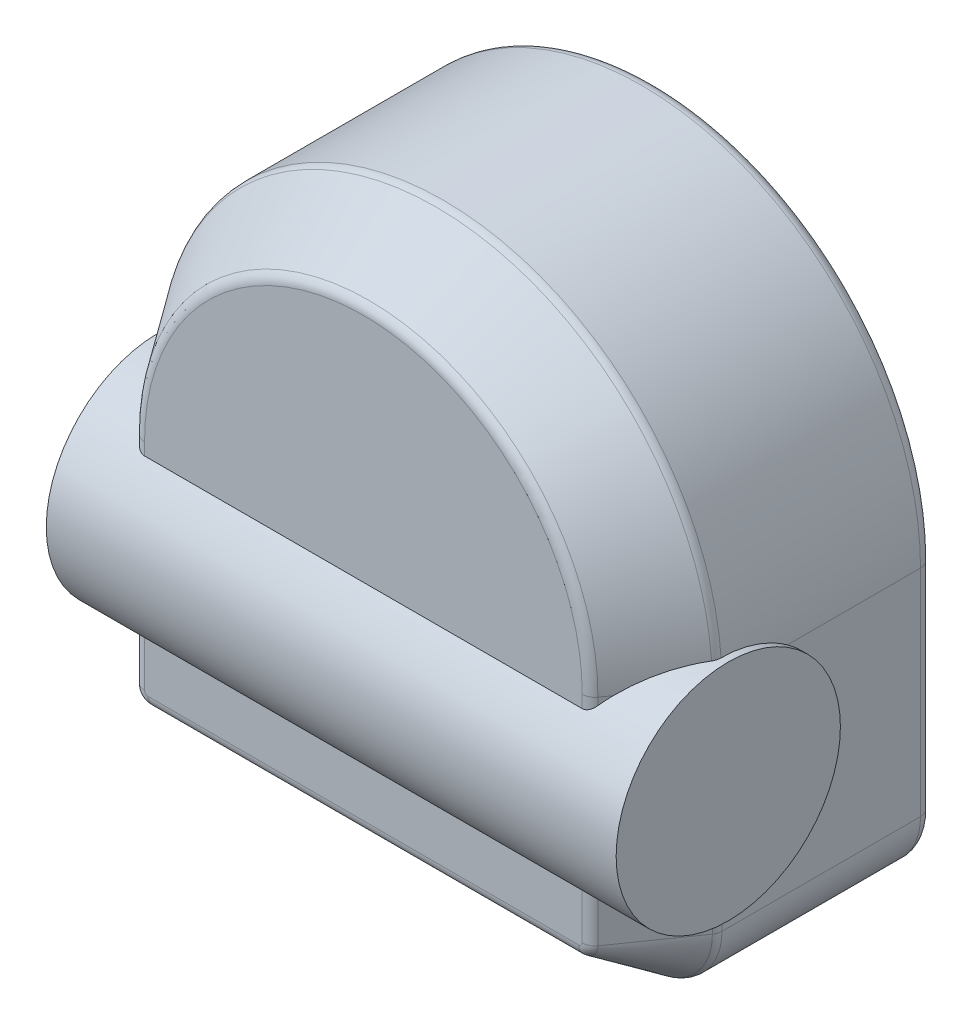
from build123d import *
from OCP.BRepFilletAPI import BRepFilletAPI_MakeChamfer

# Parameters (mm, degrees)
BOSS_EXTRUDE1_DEPTH = 115
CHAMFER3_SIZE       = 60
CHAMFER3_SIZE2      = 42.012452293
FILLET1_R           = 10
SKETCH2_R           = 88.57
BOSS_EXTRUDE2_DEPTH = 225.06
SKETCH3_R           = 50
CUT_EXTRUDE1_DEPTH  = 100


with BuildPart() as part:
    # Sketch1 → Boss-Extrude1 (new, symmetric)
    with BuildSketch(Plane.XY):
        with BuildLine():
            ThreePointArc((-220.06, 110.03), (0, 330.09), (220.06, 110.03))
            Line((220.06, 110.03), (-220.06, 110.03))
        make_face()
        with BuildLine():
            ThreePointArc((-170.06, -110.03), (-205.415339059, -95.385339059), (-220.06, -60.03))
            Line((-220.06, -60.03), (-220.06, 110.03))
            Line((-220.06, 110.03), (220.06, 110.03))
            Line((220.06, 110.03), (220.06, -60.03))
            ThreePointArc((220.06, -60.03), (205.415339059, -95.385339059), (170.06, -110.03))
            Line((170.06, -110.03), (-170.06, -110.03))
        make_face()
    extrude(amount=BOSS_EXTRUDE1_DEPTH, both=True)

    # Chamfer3: one chamfer whose edges measure the first distance from different faces: ONE call of the kernel's chamfer builder (chamfer() names one face for all edges)
    chamfer3_edges_1 = [part.edges().sort_by_distance(p)[0] for p in [
        (-220.06, 25, 115),
    ]]
    chamfer3_side_1 = [part.faces().sort_by_distance(p)[0] for p in [
        (-220.06, 25, 0),
    ]]
    chamfer3_edges_2 = [part.edges().sort_by_distance(p)[0] for p in [
        (-205.415339059, -95.385339059, 115),
    ]]
    chamfer3_side_2 = [part.faces().sort_by_distance(p)[0] for p in [
        (-205.415339059, -95.385339059, 0),
    ]]
    chamfer3_edges_3 = [part.edges().sort_by_distance(p)[0] for p in [
        (0, -110.03, 115),
    ]]
    chamfer3_side_3 = [part.faces().sort_by_distance(p)[0] for p in [
        (0, -110.03, 0),
    ]]
    chamfer3_edges_4 = [part.edges().sort_by_distance(p)[0] for p in [
        (205.415339059, -95.385339059, 115),
    ]]
    chamfer3_side_4 = [part.faces().sort_by_distance(p)[0] for p in [
        (205.415339059, -95.385339059, 0),
    ]]
    chamfer3_edges_5 = [part.edges().sort_by_distance(p)[0] for p in [
        (220.06, 25, 115),
    ]]
    chamfer3_side_5 = [part.faces().sort_by_distance(p)[0] for p in [
        (220.06, 25, 0),
    ]]
    chamfer3_edges_6 = [part.edges().sort_by_distance(p)[0] for p in [
        (0, 330.09, 115),
    ]]
    chamfer3_side_6 = [part.faces().sort_by_distance(p)[0] for p in [
        (0, 330.09, 0),
    ]]
    chamfer3 = BRepFilletAPI_MakeChamfer(part.part.solid().wrapped)
    for e in chamfer3_edges_1:
        chamfer3.Add(CHAMFER3_SIZE, CHAMFER3_SIZE2, e.wrapped, chamfer3_side_1[0].wrapped)  # the first distance lies on this face
    for e in chamfer3_edges_2:
        chamfer3.Add(CHAMFER3_SIZE, CHAMFER3_SIZE2, e.wrapped, chamfer3_side_2[0].wrapped)  # the first distance lies on this face
    for e in chamfer3_edges_3:
        chamfer3.Add(CHAMFER3_SIZE, CHAMFER3_SIZE2, e.wrapped, chamfer3_side_3[0].wrapped)  # the first distance lies on this face
    for e in chamfer3_edges_4:
        chamfer3.Add(CHAMFER3_SIZE, CHAMFER3_SIZE2, e.wrapped, chamfer3_side_4[0].wrapped)  # the first distance lies on this face
    for e in chamfer3_edges_5:
        chamfer3.Add(CHAMFER3_SIZE, CHAMFER3_SIZE2, e.wrapped, chamfer3_side_5[0].wrapped)  # the first distance lies on this face
    for e in chamfer3_edges_6:
        chamfer3.Add(CHAMFER3_SIZE, CHAMFER3_SIZE2, e.wrapped, chamfer3_side_6[0].wrapped)  # the first distance lies on this face
    add(Compound.cast(chamfer3.Shape()), mode=Mode.REPLACE)

    # Fillet1
    fillet1_edges = [part.edges().sort_by_distance(p)[0] for p in [
        (0, 330.09, -115),
        (220.06, 25, 55),
        (0, 288.077547707, 115),
        (-178.047547707, 25, 115),
        (-175.708049149, -65.678049149, 115),
        (0, -68.017547707, 115),
        (175.708049149, -65.678049149, 115),
        (178.047547707, 25, 115),
        (205.415339059, -95.385339059, 55),
        (0, -110.03, 55),
        (-205.415339059, -95.385339059, 55),
        (-220.06, 25, 55),
        (0, 330.09, 55),
        (220.06, 25, -115),
        (205.415339059, -95.385339059, -115),
        (0, -110.03, -115),
        (-205.415339059, -95.385339059, -115),
        (-220.06, 25, -115),
    ]]
    fillet(fillet1_edges, radius=FILLET1_R)

    # Sketch2 → Boss-Extrude2 (add, symmetric)
    with BuildSketch(Plane(origin=(0, 0, 0), x_dir=(0, 0, -1), z_dir=(1, 0, 0))):
        with Locations((-51.847012111, 38.15)):
            Circle(SKETCH2_R)
    extrude(amount=BOSS_EXTRUDE2_DEPTH, both=True)

    # Sketch3 → Cut-Extrude1 (cut)
    with BuildSketch(Plane(origin=(0, 0, -115), x_dir=(-1, 0, 0), z_dir=(0, 0, -1))):
        with Locations((0, 110.03)):
            Circle(SKETCH3_R)
    extrude(amount=-CUT_EXTRUDE1_DEPTH, mode=Mode.SUBTRACT)


solid = part.part
